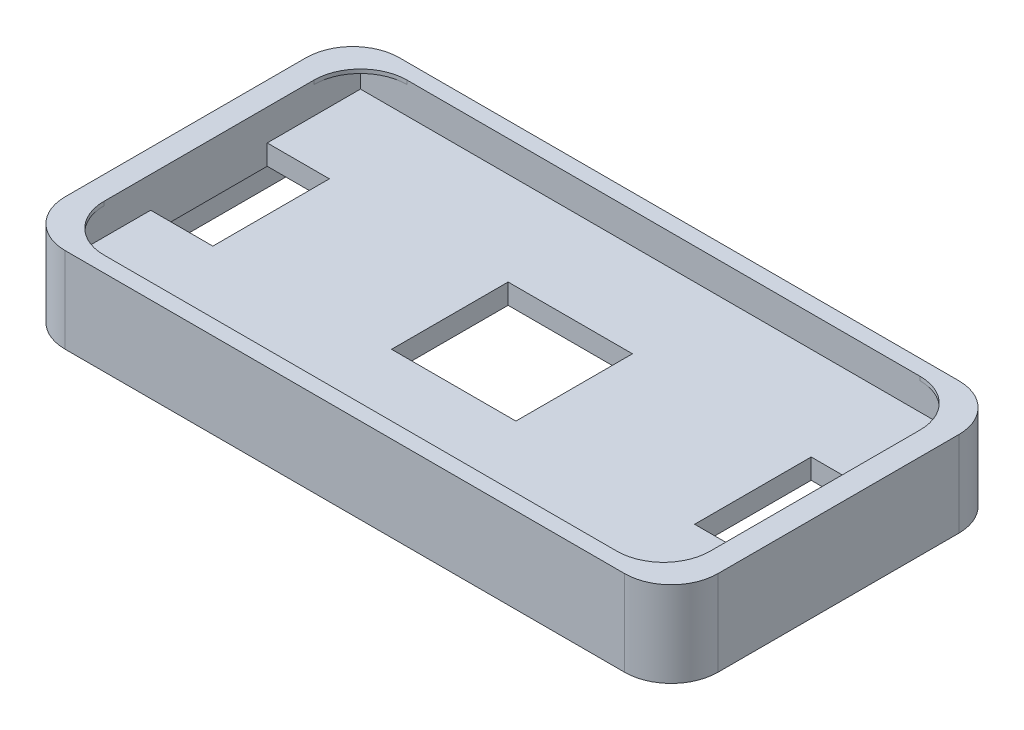
from build123d import *

# Parameters (mm, degrees)
EXTRUDE_1_DEPTH     = 10.5
CUT_EXTRUDE_1_DEPTH = 1
SKETCH_3_R          = 2.5
SKETCH_3_R_2        = 1.65
CUT_EXTRUDE_2_DEPTH = 3.4
SKETCH_4_W          = 78
SKETCH_4_H          = 39
CUT_EXTRUDE_3_DEPTH = 3.5
SKETCH_5_W          = 8
SKETCH_5_H          = 15
CUT_EXTRUDE_4_DEPTH = 48.699580711
SKETCH_6_W          = 16
SKETCH_6_H          = 15
CUT_EXTRUDE_5_DEPTH = 48.699580711
EXTRUDE_2_DEPTH     = 0.5


with BuildPart() as part:
    # 草图1 → 凸台-拉伸1 (new body)
    with BuildSketch(Plane(origin=(0, 0, 0), x_dir=(1, 0, 0), z_dir=(0, 1, 0))):
        with BuildLine():
            Line((-36, 21.5), (36, 21.5))
            ThreePointArc((36, 21.5), (40.242640687, 19.742640687), (42, 15.5))
            Line((42, 15.5), (42, -15.5))
            ThreePointArc((42, -15.5), (40.242640687, -19.742640687), (36, -21.5))
            Line((36, -21.5), (-36, -21.5))
            ThreePointArc((-36, -21.5), (-40.242640687, -19.742640687), (-42, -15.5))
            Line((-42, -15.5), (-42, 15.5))
            ThreePointArc((-42, 15.5), (-40.242640687, 19.742640687), (-36, 21.5))
        make_face()
    extrude(amount=EXTRUDE_1_DEPTH)

    # 草图2 → 切除-拉伸1 (cut)
    with BuildSketch(Plane.XZ):
        with BuildLine():
            Line((36, 20.5), (-36, 20.5))
            ThreePointArc((-36, 20.5), (-39.535533906, 19.035533906), (-41, 15.5))
            Line((-41, 15.5), (-41, -15.5))
            ThreePointArc((-41, -15.5), (-39.535533906, -19.035533906), (-36, -20.5))
            Line((-36, -20.5), (36, -20.5))
            ThreePointArc((36, -20.5), (39.535533906, -19.035533906), (41, -15.5))
            Line((41, -15.5), (41, 15.5))
            ThreePointArc((41, 15.5), (39.535533906, 19.035533906), (36, 20.5))
        make_face()
    extrude(amount=-CUT_EXTRUDE_1_DEPTH, mode=Mode.SUBTRACT)

    # 草图3 → 切除-拉伸2 (cut)
    # profile 1 of 5: a face of its own
    with BuildSketch(Plane(origin=(0, 1, 0), x_dir=(-1, 0, 0), z_dir=(0, -1, 0))):
        with BuildLine():
            Line((-41, 15.5), (-41, -15.5))
            ThreePointArc((-41, -15.5), (-39.535533906, -19.035533906), (-36, -20.5))
            Line((-36, -20.5), (36, -20.5))
            ThreePointArc((36, -20.5), (39.535533906, -19.035533906), (41, -15.5))
            Line((41, -15.5), (41, 15.5))
            ThreePointArc((41, 15.5), (39.535533906, 19.035533906), (36, 20.5))
            Line((36, 20.5), (-36, 20.5))
            ThreePointArc((-36, 20.5), (-39.535533906, 19.035533906), (-41, 15.5))
        make_face()
        with Locations(Location((36, 15.5, 0), (0, 0, 90))):
            Circle(SKETCH_3_R, mode=Mode.SUBTRACT)
        with Locations(Location((36, -15.5, 0), (0, 0, 90))):
            Circle(SKETCH_3_R, mode=Mode.SUBTRACT)
        with Locations(Location((-36, 15.5, 0), (0, 0, 90))):
            Circle(SKETCH_3_R, mode=Mode.SUBTRACT)
        with Locations(Location((-36, -15.5, 0), (0, 0, 90))):
            Circle(SKETCH_3_R, mode=Mode.SUBTRACT)
    # profile 2 of 5: a face of its own
    with BuildSketch(Plane(origin=(0, 1, 0), x_dir=(-1, 0, 0), z_dir=(0, -1, 0))):
        with Locations(Location((36, 15.5, 0), (0, 0, 90))):
            Circle(SKETCH_3_R_2)
    # profile 3 of 5: a face of its own
    with BuildSketch(Plane(origin=(0, 1, 0), x_dir=(-1, 0, 0), z_dir=(0, -1, 0))):
        with Locations(Location((36, -15.5, 0), (0, 0, 90))):
            Circle(SKETCH_3_R_2)
    # profile 4 of 5: a face of its own
    with BuildSketch(Plane(origin=(0, 1, 0), x_dir=(-1, 0, 0), z_dir=(0, -1, 0))):
        with Locations(Location((-36, -15.5, 0), (0, 0, 90))):
            Circle(SKETCH_3_R_2)
    # profile 5 of 5: a face of its own
    with BuildSketch(Plane(origin=(0, 1, 0), x_dir=(-1, 0, 0), z_dir=(0, -1, 0))):
        with Locations(Location((-36, 15.5, 0), (0, 0, 90))):
            Circle(SKETCH_3_R_2)
    extrude(amount=-CUT_EXTRUDE_2_DEPTH, mode=Mode.SUBTRACT)

    # 草图4 → 切除-拉伸3 (cut)
    with BuildSketch(Plane(origin=(0, 10.5, 0), x_dir=(1, 0, 0), z_dir=(0, 1, 0))):
        Rectangle(SKETCH_4_W, SKETCH_4_H)
    extrude(amount=-CUT_EXTRUDE_3_DEPTH, mode=Mode.SUBTRACT)

    # 草图5 → 切除-拉伸4 (cut, through all)
    with BuildSketch(Plane(origin=(0, 7, 0), x_dir=(1, 0, 0), z_dir=(0, 1, 0))):
        with Locations((-35, 0)):
            Rectangle(SKETCH_5_W, SKETCH_5_H)
        with Locations((35, 0)):
            Rectangle(SKETCH_5_W, SKETCH_5_H)
    extrude(amount=-CUT_EXTRUDE_4_DEPTH, mode=Mode.SUBTRACT)

    # 草图6 → 切除-拉伸5 (cut, through all)
    with BuildSketch(Plane(origin=(0, 7, 0), x_dir=(1, 0, 0), z_dir=(0, 1, 0))):
        Rectangle(SKETCH_6_W, SKETCH_6_H)
    extrude(amount=-CUT_EXTRUDE_5_DEPTH, mode=Mode.SUBTRACT)

    # 草图7 → 凸台-拉伸2 (add)
    with BuildSketch(Plane(origin=(0, 10.5, 0), x_dir=(1, 0, 0), z_dir=(0, 1, 0))):
        with BuildLine():
            Line((42, -15.5), (42, 15.5))
            ThreePointArc((42, 15.5), (40.242640687, 19.742640687), (36, 21.5))
            Line((36, 21.5), (-36, 21.5))
            ThreePointArc((-36, 21.5), (-40.242640687, 19.742640687), (-42, 15.5))
            Line((-42, 15.5), (-42, -15.5))
            ThreePointArc((-42, -15.5), (-40.242640687, -19.742640687), (-36, -21.5))
            Line((-36, -21.5), (36, -21.5))
            ThreePointArc((36, -21.5), (40.242640687, -19.742640687), (42, -15.5))
        make_face()
        with BuildLine():
            Line((-33, -19.5), (33, -19.5))
            ThreePointArc((33, -19.5), (37.242640687, -17.742640687), (39, -13.5))
            Line((39, -13.5), (39, 13.5))
            ThreePointArc((39, 13.5), (37.242640687, 17.742640687), (33, 19.5))
            Line((33, 19.5), (-33, 19.5))
            ThreePointArc((-33, 19.5), (-37.242640687, 17.742640687), (-39, 13.5))
            Line((-39, 13.5), (-39, -13.5))
            ThreePointArc((-39, -13.5), (-37.242640687, -17.742640687), (-33, -19.5))
        make_face(mode=Mode.SUBTRACT)
    extrude(amount=EXTRUDE_2_DEPTH)


solid = part.part
